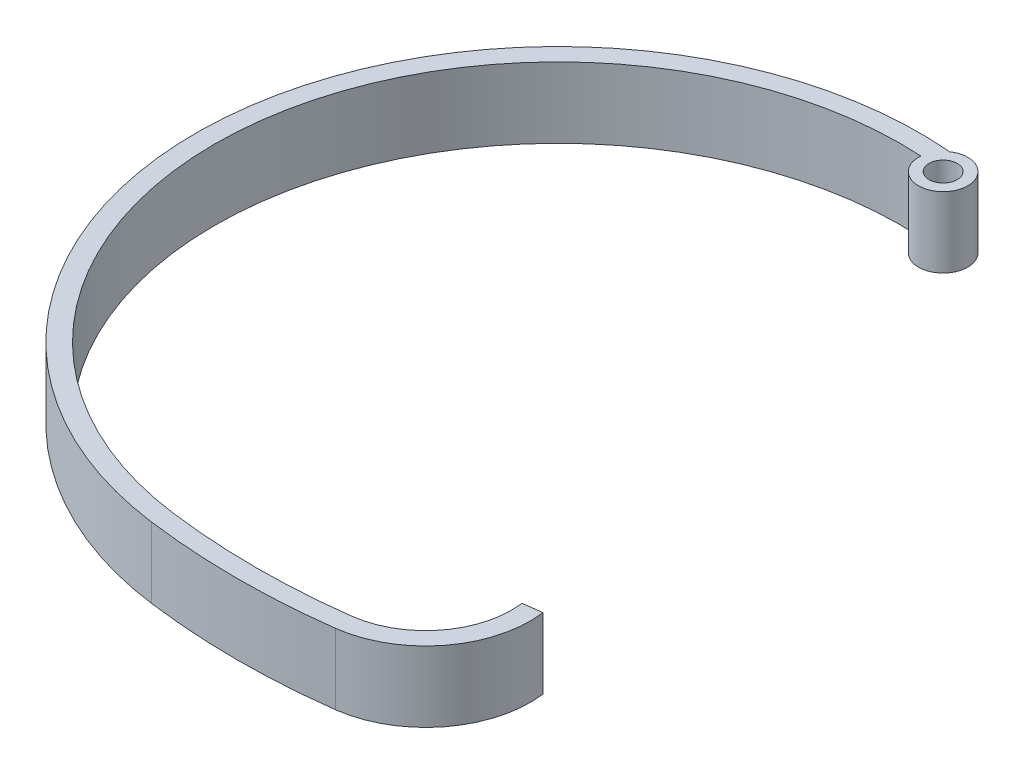
from build123d import *

# Parameters (mm, degrees)
ESQUISSE1_R        = 3
BOSS_EXTRU_3_DEPTH = 15
ESQUISSE7_W        = 1.25
ESQUISSE7_H        = 5.244372399


with BuildPart() as part:
    # Esquisse1 → Boss.-Extru.3 (new body)
    with BuildSketch(Plane(origin=(0, 0, 0), x_dir=(1, 0, 0), z_dir=(0, 1, 0))):
        with BuildLine():
            Line((34.729410673, -124.285932568), (38.695354514, -123.765078027))
            ThreePointArc((38.695354514, -123.765078027), (34.282632836, -140.212837317), (19.532045284, -148.722894024))
            ThreePointArc((19.532045284, -148.722894024), (-0.023643562, -149.999998137), (-19.578928833, -148.716729206))
            ThreePointArc((-19.578928833, -148.716729206), (-86.077469284, -64.054307062), (-2.940851082, 4.342215653))
            ThreePointArc((-2.940851082, 4.342215653), (4.510953097, -2.674835324), (-5.220739084, 0.49731808))
            ThreePointArc((-5.220739084, 0.49731808), (-82.19944379, -65.452964988), (-19.056824064, -144.750949761))
            ThreePointArc((-19.056824064, -144.750949761), (-0.023013067, -145.999998186), (19.011190743, -144.756950184))
            ThreePointArc((19.011190743, -144.756950184), (31.109987274, -137.776791312), (34.729410673, -124.285932568))
        make_face()
        with Locations(Location((0, 0, 0), (0, 0, 270))):
            Circle(ESQUISSE1_R, mode=Mode.SUBTRACT)
    extrude(amount=BOSS_EXTRU_3_DEPTH)

    # Esquisse7 → Trou taraudé M3x0.51 (revolve, cut)
    with BuildSketch(Plane(origin=(0, 7.5, 0), x_dir=(0, -1, 0), z_dir=(1, 0, 0))):
        with Locations((0.625, 2.6221862)):
            Rectangle(ESQUISSE7_W, ESQUISSE7_H)
    revolve(axis=Axis((0, 7.5, 6.35), (0, 0, -1)), mode=Mode.SUBTRACT)


solid = part.part
